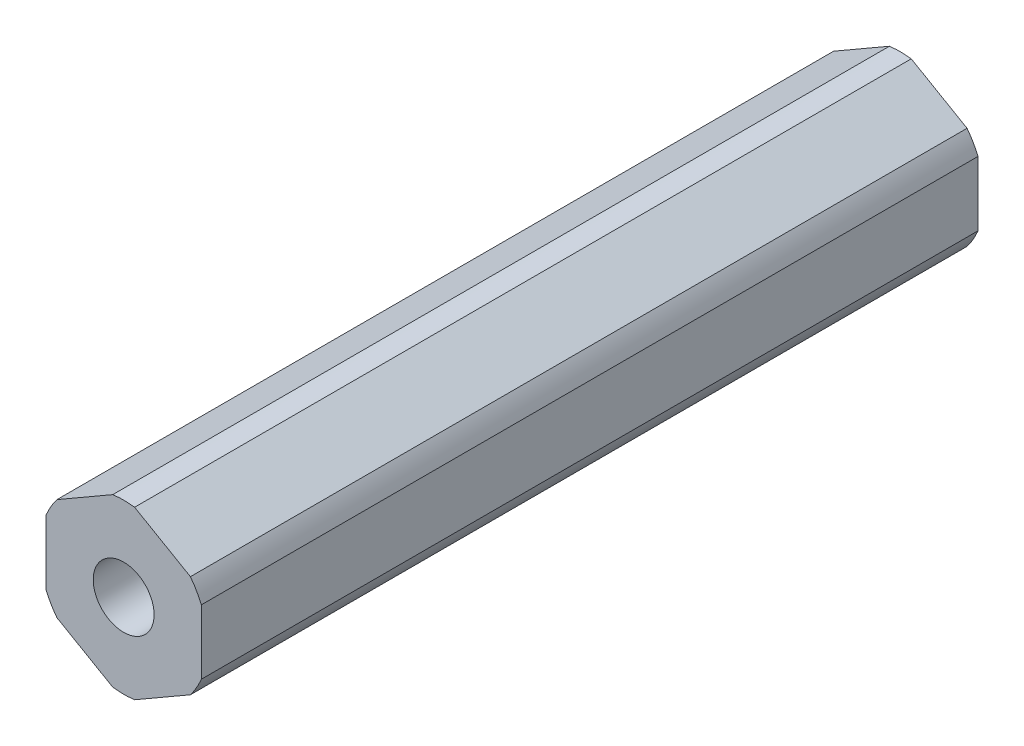
from build123d import *

# Parameters (mm, degrees)
BOSS_EXTRUDE1_DEPTH = 31.75
SKETCH3_R           = 2.4892
CUT_EXTRUDE1_DEPTH  = 65.185965172


with BuildPart() as part:
    # Sketch1 → Boss-Extrude1 (new, symmetric)
    with BuildSketch(Plane.XY):
        with BuildLine():
            Line((-0.893039494, 6.816751826), (-5.456960506, 4.181770802))
            ThreePointArc((-5.456960506, 4.181770802), (-5.953924651, 3.4375), (-6.35, 2.634981025))
            Line((-6.35, 2.634981025), (-6.35, -2.634981025))
            ThreePointArc((-6.35, -2.634981025), (-5.953924651, -3.4375), (-5.456960506, -4.181770802))
            Line((-5.456960506, -4.181770802), (-0.893039494, -6.816751826))
            ThreePointArc((-0.893039494, -6.816751826), (0, -6.875), (0.893039494, -6.816751826))
            Line((0.893039494, -6.816751826), (5.456960506, -4.181770802))
            ThreePointArc((5.456960506, -4.181770802), (5.953924651, -3.4375), (6.35, -2.634981025))
            Line((6.35, -2.634981025), (6.35, 2.634981025))
            ThreePointArc((6.35, 2.634981025), (5.953924651, 3.4375), (5.456960506, 4.181770802))
            Line((5.456960506, 4.181770802), (0.893039494, 6.816751826))
            ThreePointArc((0.893039494, 6.816751826), (0, 6.875), (-0.893039494, 6.816751826))
        make_face()
    extrude(amount=BOSS_EXTRUDE1_DEPTH, both=True)

    # Sketch3 → Cut-Extrude1 (cut, through all)
    with BuildSketch(Plane.XY.offset(31.75)):
        Circle(SKETCH3_R)
    extrude(amount=-CUT_EXTRUDE1_DEPTH, mode=Mode.SUBTRACT)


solid = part.part
